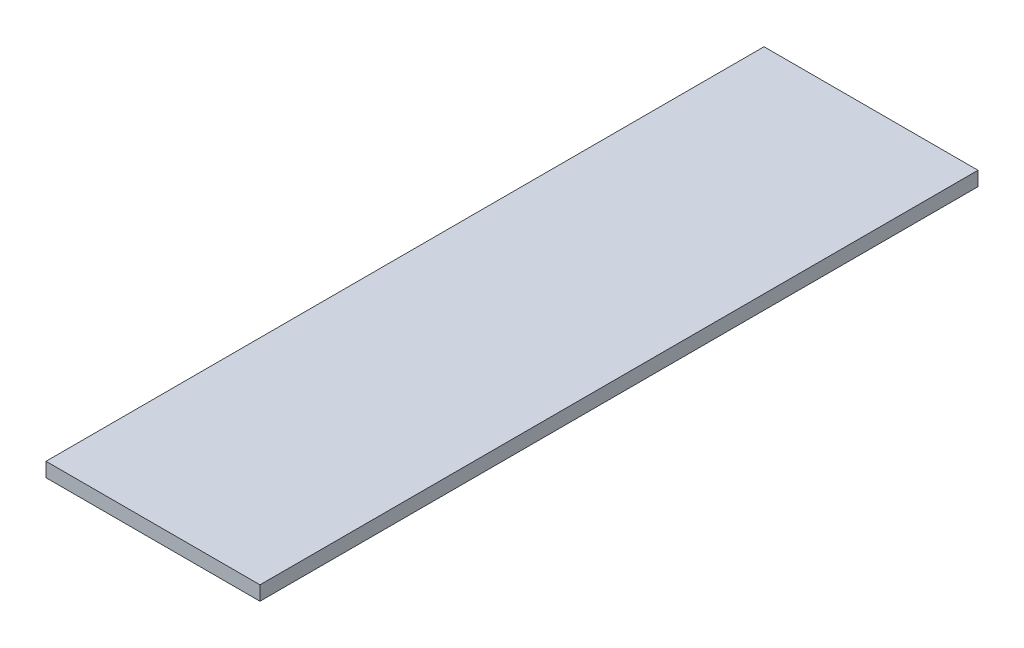
from build123d import *

# Parameters (mm, degrees)
SKETCH1_W           = 1510
SKETCH1_H           = 30
BOSS_EXTRUDE1_DEPTH = 225


with BuildPart() as part:
    # Sketch1 → Boss-Extrude1 (new, symmetric)
    with BuildSketch(Plane(origin=(0, 0, 0), x_dir=(0, 0, -1), z_dir=(1, 0, 0))):
        Rectangle(SKETCH1_W, SKETCH1_H)
    extrude(amount=BOSS_EXTRUDE1_DEPTH, both=True)


solid = part.part
